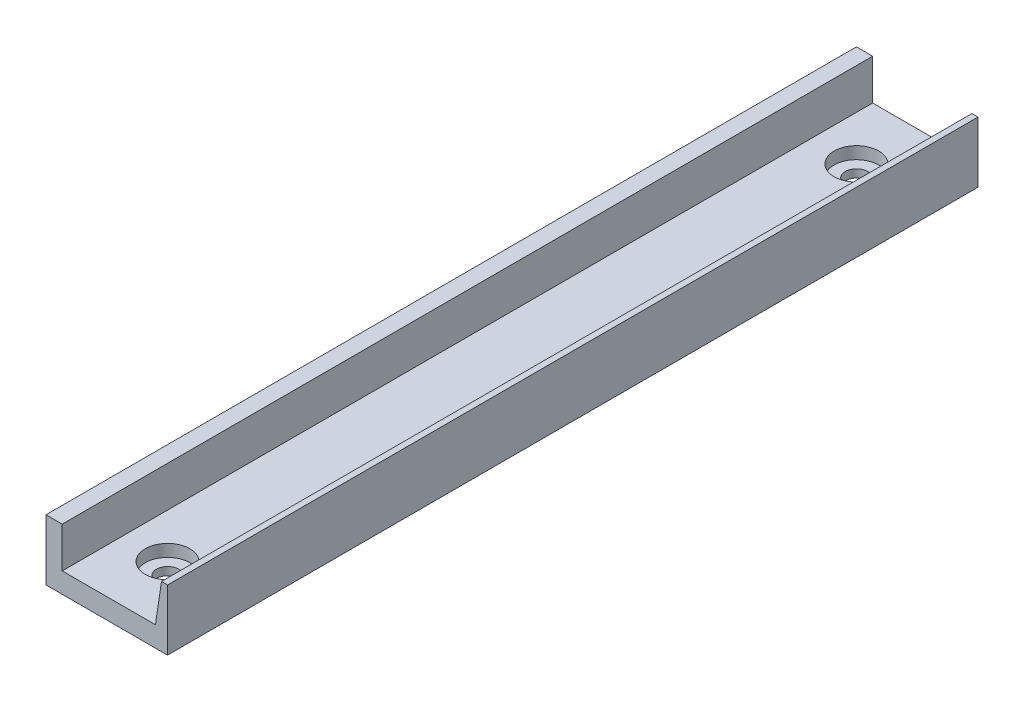
from build123d import *

# Parameters (mm, degrees)
SKETCH_1_W                   = 30
SKETCH_1_H                   = 200
EXTRUDE_1_DEPTH              = 5
SKETCH_2_W                   = 4
SKETCH_2_H                   = 200
SKETCH_2_W_2                 = 3
EXTRUDE_2_DEPTH              = 10
CUT_EXTRUDE_1_DEPTH          = 202.121853611
HOLE_WIZARD_M5_1_D           = 5.5
HOLE_WIZARD_M5_1_DEPTH       = 30
HOLE_WIZARD_M5_1_CBORE_D     = 11
HOLE_WIZARD_M5_1_CBORE_DEPTH = 3
HOLE_WIZARD_M5_1_TIP         = 1.652366702
SKETCH_7_W                   = 6.1
SKETCH_7_H                   = 120
EXTRUDE_3_DEPTH              = 6


with BuildPart() as part:
    # 스케치1 → 보스-돌출1 (new body)
    with BuildSketch(Plane(origin=(0, 0, 0), x_dir=(1, 0, 0), z_dir=(0, 1, 0))):
        Rectangle(SKETCH_1_W, SKETCH_1_H)
    extrude(amount=EXTRUDE_1_DEPTH)

    # 스케치2 → 보스-돌출2 (add)
    with BuildSketch(Plane(origin=(0, 5, 0), x_dir=(1, 0, 0), z_dir=(0, 1, 0))):
        with Locations((-13, 0)):
            Rectangle(SKETCH_2_W, SKETCH_2_H)
        with Locations((13.5, 0)):
            Rectangle(SKETCH_2_W_2, SKETCH_2_H)
    extrude(amount=EXTRUDE_2_DEPTH)

    # 스케치3 → 컷-돌출1 (cut, through all)
    with BuildSketch(Plane.XY.offset(100)):
        Polygon((12, 5), (12, 15), (13.5, 15), align=None)
    extrude(amount=-CUT_EXTRUDE_1_DEPTH, mode=Mode.SUBTRACT)

    # M5 소켓 머리 캡 나사용 카운터보어1
    with Locations(Plane(origin=(0, 5, 0), x_dir=(1, 0, 0), z_dir=(0, 1, 0))):
        with Locations((0, -85), (0, 85)):
            CounterBoreHole(HOLE_WIZARD_M5_1_D / 2, HOLE_WIZARD_M5_1_CBORE_D / 2, HOLE_WIZARD_M5_1_CBORE_DEPTH, depth=HOLE_WIZARD_M5_1_DEPTH)
            with Locations((0, 0, -(HOLE_WIZARD_M5_1_DEPTH + HOLE_WIZARD_M5_1_TIP / 2))):  # 118° drill point
                Cone(0, HOLE_WIZARD_M5_1_D / 2, HOLE_WIZARD_M5_1_TIP, mode=Mode.SUBTRACT)

    # 스케치7 → 보스-돌출3 (add)
    with BuildSketch(Plane.XZ):
        Rectangle(SKETCH_7_W, SKETCH_7_H)
    extrude(amount=EXTRUDE_3_DEPTH)


solid = part.part
